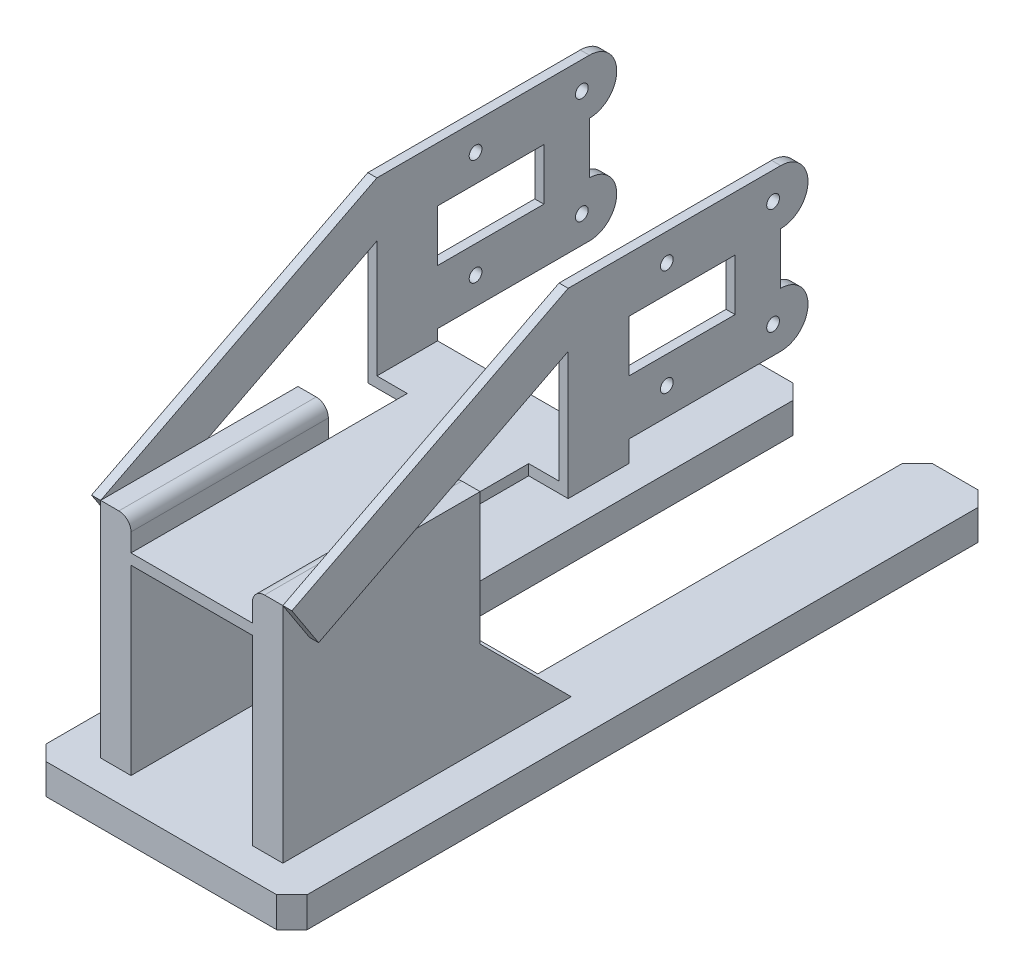
from build123d import *

# Parameters (mm, degrees)
SKETCH_1_W               = 60
SKETCH_1_H               = 3
EXTRUDE_1_DEPTH          = 65
SKETCH_2_W               = 40
SKETCH_2_H               = 3.5
EXTRUDE_2_DEPTH          = 46
EXTRUDE_3_DEPTH          = 3.5
SKETCH_5_W               = 35
SKETCH_5_H               = 17
EXTRUDE_4_DEPTH          = 3
EXTRUDE_START            = 3
SKETCH_6_W               = 35
SKETCH_6_H               = 17
SKETCH_6_W_2             = 20
SKETCH_6_H_2             = 3.5
EXTRUDE_5_DEPTH          = 3
SKETCH_7_W               = 36
SKETCH_7_H               = 10
SKETCH_7_W_2             = 10
SKETCH_7_H_2             = 65
EXTRUDE_6_DEPTH          = 60
SKETCH_8_W               = 66
SKETCH_8_H               = 111
EXTRUDE_7_DEPTH          = 10
SKETCH_9_W               = 15
SKETCH_9_H               = 10
EXTRUDE_8_DEPTH          = 110
SKETCH_10_W              = 36
SKETCH_10_H              = 70
CUT_EXTRUDE_2_DEPTH      = 15
SKETCH_13_W              = 221
SKETCH_13_H              = 10
EXTRUDE_9_DEPTH          = 10
SKETCH_14_W              = 221
SKETCH_14_H              = 10
EXTRUDE_10_DEPTH         = 10
SKETCH_15_W              = 86
SKETCH_15_H              = 10
EXTRUDE_11_DEPTH         = 10
CHAMFER_1_SIZE           = 30
CHAMFER_2_SIZE           = 30
CUT_EXTRUDE_3_DEPTH      = 15
CUT_EXTRUDE_3_DEPTH_BACK = 75
SKETCH_16_R              = 2.1
CHAMFER_3_SIZE           = 5


with BuildPart() as part:
    # 草图1 → 凸台-拉伸1 (new body)
    with BuildSketch(Plane.XY):
        with Locations((0, -32)):
            Rectangle(SKETCH_1_W, SKETCH_1_H)
        with BuildLine():
            Line((-20, -24), (-20, -28))
            Line((-20, -28), (-20, -30))
            Line((-20, -30), (20, -30))
            Line((20, -30), (20, -28))
            Line((20, -28), (20, -24))
            ThreePointArc((20, -24), (21.171572875, -21.171572875), (24, -20))
            Line((24, -20), (28, -20))
            Line((28, -20), (30, -20))
            Line((30, -20), (30, -30.5))
            Line((30, -30.5), (-30, -30.5))
            Line((-30, -30.5), (-30, -20))
            Line((-30, -20), (-28, -20))
            Line((-28, -20), (-24, -20))
            ThreePointArc((-24, -20), (-21.171572875, -21.171572875), (-20, -24))
        make_face()
    extrude(amount=EXTRUDE_1_DEPTH)

    # 草图2 → 凸台-拉伸2 (add)
    with BuildSketch(Plane(origin=(0, 0, 0), x_dir=(-1, 0, 0), z_dir=(0, 0, -1))):
        with Locations((0, -31.75)):
            Rectangle(SKETCH_2_W, SKETCH_2_H)
    extrude(amount=EXTRUDE_2_DEPTH)

    # 草图4 → 凸台-拉伸3 (add)
    with BuildSketch(Plane.XZ.offset(33.5)):
        Polygon((20, -46), (30, -46), (30, -26), (20, -26), (-30, -26), (-30, -46), align=None)
    extrude(amount=-EXTRUDE_3_DEPTH)

    # 草图5 → 凸台-拉伸4 (add)
    with BuildSketch(Plane.ZY.offset(30)):
        with BuildLine():
            Line((-46, -26.5), (-46, -33.5))
            Line((-46, -33.5), (-26, -33.5))
            Line((-26, -33.5), (-26, 8.5))
            Line((-26, 8.5), (56.193548387, -33.5))
            Line((56.193548387, -33.5), (65, -20))
            Line((65, -20), (-26, 26.5))
            Line((-26, 26.5), (-96, 26.5))
            ThreePointArc((-96, 26.5), (-105, 17.5), (-96, 8.5))
            Line((-96, 8.5), (-96, -8.5))
            ThreePointArc((-96, -8.5), (-105, -17.5), (-96, -26.5))
            Line((-96, -26.5), (-46, -26.5))
        make_face()
        with Locations((-63.5, 0)):
            Rectangle(SKETCH_5_W, SKETCH_5_H, mode=Mode.SUBTRACT)
    extrude(amount=EXTRUDE_4_DEPTH)

    # 草图6 → 凸台-拉伸5 (add)
    # profile 1 of 3: a face of its own
    with BuildSketch(Plane(origin=(30, 0, 0), x_dir=(0, 0, -1), z_dir=(1, 0, 0)).offset(EXTRUDE_START)):
        Polygon((26, 8.5), (26, 26.5), (-65, -20), (-56.193548387, -33.5), align=None)
    # profile 2 of 3: a face of its own
    with BuildSketch(Plane(origin=(30, 0, 0), x_dir=(0, 0, -1), z_dir=(1, 0, 0)).offset(EXTRUDE_START)):
        with BuildLine():
            Line((96, 26.5), (46, 26.5))
            Line((46, 26.5), (26, 26.5))
            Line((26, 26.5), (26, 8.5))
            Line((26, 8.5), (26, -30))
            Line((26, -30), (46, -30))
            Line((46, -30), (46, -26.5))
            Line((46, -26.5), (96, -26.5))
            ThreePointArc((96, -26.5), (105, -17.5), (96, -8.5))
            Line((96, -8.5), (96, 8.5))
            ThreePointArc((96, 8.5), (105, 17.5), (96, 26.5))
        make_face()
        with Locations((63.5, 0)):
            Rectangle(SKETCH_6_W, SKETCH_6_H, mode=Mode.SUBTRACT)
    # profile 3 of 3: a face of its own
    with BuildSketch(Plane(origin=(30, 0, 0), x_dir=(0, 0, -1), z_dir=(1, 0, 0)).offset(EXTRUDE_START)):
        with Locations((36, -31.75)):
            Rectangle(SKETCH_6_W_2, SKETCH_6_H_2)
    extrude(amount=-EXTRUDE_5_DEPTH)

    # 草图7 → 凸台-拉伸6 (add)
    with BuildSketch(Plane.XZ.offset(33.5)):
        with Locations((0, -41)):
            Rectangle(SKETCH_7_W, SKETCH_7_H)
        with Locations((-25, 32.5)):
            Rectangle(SKETCH_7_W_2, SKETCH_7_H_2)
        with Locations((25, 32.5)):
            Rectangle(SKETCH_7_W_2, SKETCH_7_H_2)
    extrude(amount=EXTRUDE_6_DEPTH)

    # 草图8 → 凸台-拉伸7 (add)
    with BuildSketch(Plane.XZ.offset(93.5)):
        with Locations((0, 9.5)):
            Rectangle(SKETCH_8_W, SKETCH_8_H)
    extrude(amount=EXTRUDE_7_DEPTH)

    # 草图9 → 凸台-拉伸8 (add)
    with BuildSketch(Plane(origin=(0, 0, -46), x_dir=(-1, 0, 0), z_dir=(0, 0, -1))):
        with Locations((25.5, -98.5)):
            Rectangle(SKETCH_9_W, SKETCH_9_H)
        with Locations((-25.5, -98.5)):
            Rectangle(SKETCH_9_W, SKETCH_9_H)
    extrude(amount=EXTRUDE_8_DEPTH)

    # 草图10 → 切除-拉伸2 (cut)
    with BuildSketch(Plane(origin=(0, 0, -46), x_dir=(-1, 0, 0), z_dir=(0, 0, -1))):
        with Locations((0, -68.5)):
            Rectangle(SKETCH_10_W, SKETCH_10_H)
    extrude(amount=-CUT_EXTRUDE_2_DEPTH, mode=Mode.SUBTRACT)

    # 草图13 → 凸台-拉伸9 (add)
    with BuildSketch(Plane.ZY.offset(33)):
        with Locations((-45.5, -98.5)):
            Rectangle(SKETCH_13_W, SKETCH_13_H)
    extrude(amount=EXTRUDE_9_DEPTH)

    # 草图14 → 凸台-拉伸10 (add)
    with BuildSketch(Plane(origin=(33, 0, 0), x_dir=(0, 0, -1), z_dir=(1, 0, 0))):
        with Locations((45.5, -98.5)):
            Rectangle(SKETCH_14_W, SKETCH_14_H)
    extrude(amount=EXTRUDE_10_DEPTH)

    # 草图15 → 凸台-拉伸11 (add)
    with BuildSketch(Plane.XY.offset(65)):
        with Locations((0, -98.5)):
            Rectangle(SKETCH_15_W, SKETCH_15_H)
    extrude(amount=EXTRUDE_11_DEPTH)

    # 倒角1
    chamfer_1_edges = [part.edges().sort_by_distance(p)[0] for p in [
        (25, -93.5, 0),
    ]]
    chamfer(chamfer_1_edges, length=CHAMFER_1_SIZE)

    # 倒角2
    chamfer_2_edges = [part.edges().sort_by_distance(p)[0] for p in [
        (-25, -93.5, 0),
    ]]
    chamfer(chamfer_2_edges, length=CHAMFER_2_SIZE)

    # 草图16 → 切除-拉伸3 (cut, two sides: drawn at the far end of the back side and taken through both)
    with BuildSketch(Plane(origin=(33, 0, 0), x_dir=(0, 0, -1), z_dir=(1, 0, 0)).offset(-CUT_EXTRUDE_3_DEPTH_BACK)):
        with Locations((93.5, 17.5)):
            Circle(SKETCH_16_R)
        with Locations((58.5, 17.5)):
            Circle(SKETCH_16_R)
        with Locations((58.5, -17.5)):
            Circle(SKETCH_16_R)
        with Locations((93.5, -17.5)):
            Circle(SKETCH_16_R)
    extrude(amount=CUT_EXTRUDE_3_DEPTH + CUT_EXTRUDE_3_DEPTH_BACK, mode=Mode.SUBTRACT)

    # 倒角3
    chamfer_3_edges = [part.edges().sort_by_distance(p)[0] for p in [
        (-18, -98.5, -156),
        (18, -98.5, -156),
        (-43, -98.5, -156),
        (43, -98.5, -156),
        (-43, -98.5, 75),
        (43, -98.5, 75),
    ]]
    chamfer(chamfer_3_edges, length=CHAMFER_3_SIZE)


solid = part.part
